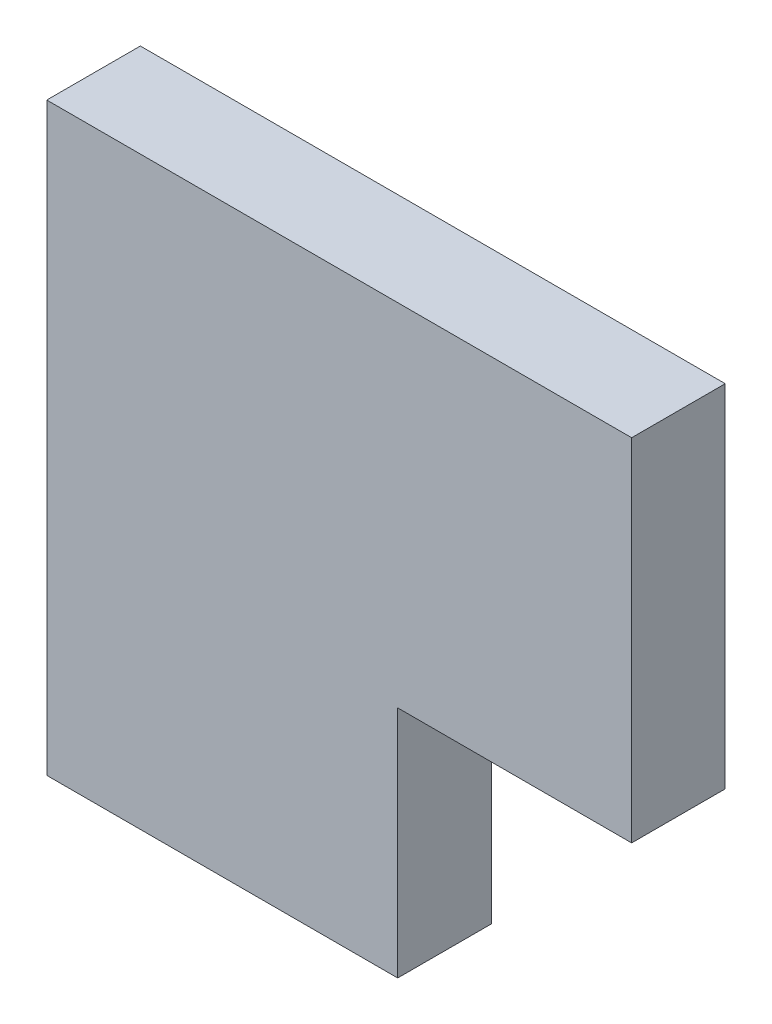
from build123d import *

# Parameters (mm, degrees)
BOSS_EXTRUDE1_DEPTH = 0.2


with BuildPart() as part:
    # Sketch1 → Boss-Extrude1 (new, symmetric)
    with BuildSketch(Plane.XY):
        Polygon((0, 0), (0, 1.5), (-2.5, 1.5), (-2.5, -1), (-1, -1), (-1, 0), align=None)
    extrude(amount=BOSS_EXTRUDE1_DEPTH, both=True)


solid = part.part
